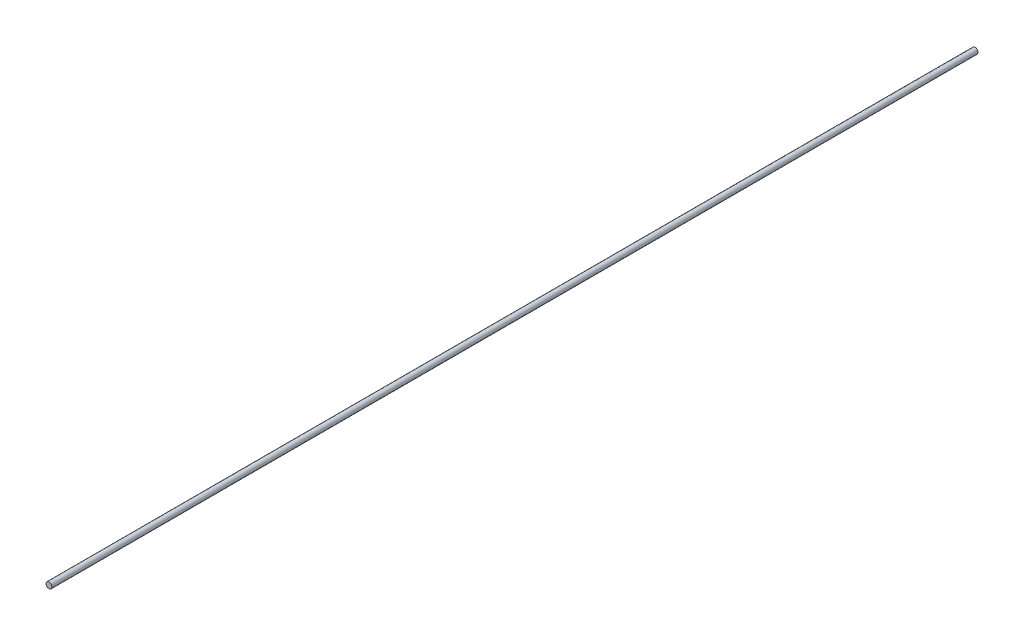
from build123d import *

# Parameters (mm, degrees)
ESBO_O1_R                = 4.7625
RESSALTO_EXTRUS_O1_DEPTH = 1500


with BuildPart() as part:
    # Esboço1 → Ressalto-extrusão1 (new body)
    with BuildSketch(Plane.XY):
        Circle(ESBO_O1_R)
    extrude(amount=RESSALTO_EXTRUS_O1_DEPTH)


solid = part.part
